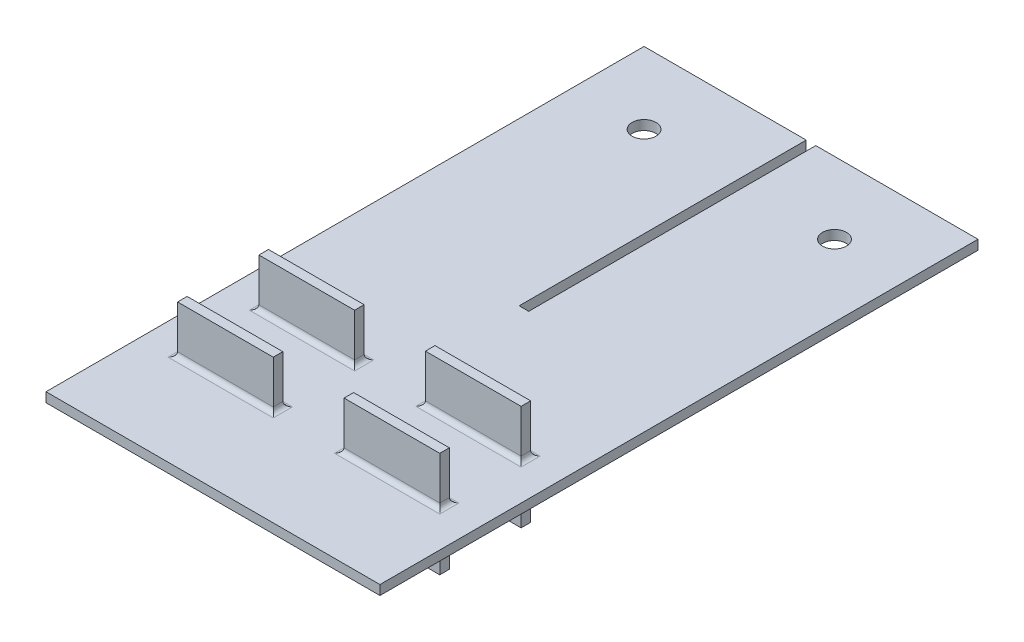
from build123d import *

# Parameters (mm, degrees)
SKETCH1_R           = 2.5
BOSS_EXTRUDE1_DEPTH = 1
SKETCH2_W           = 20
SKETCH2_H           = 2
BOSS_EXTRUDE2_DEPTH = 10
FILLET2_R           = 1
FILLET3_R           = 1


with BuildPart() as part:
    # Sketch1 → Boss-Extrude1 (new, symmetric)
    with BuildSketch(Plane(origin=(0, 0, 0), x_dir=(1, 0, 0), z_dir=(0, 1, 0))):
        Polygon((1, 62.5), (34.9, 62.5), (34.9, -62.5), (-34.9, -62.5), (-34.9, 62.5), (-1, 62.5), (-1, 2.5), (1, 2.5), align=None)
        with Locations(Location((-19.9, 47.5, 0), (0, 0, 270))):
            Circle(SKETCH1_R, mode=Mode.SUBTRACT)
        with Locations(Location((19.9, 47.5, 0), (0, 0, 270))):
            Circle(SKETCH1_R, mode=Mode.SUBTRACT)
    extrude(amount=BOSS_EXTRUDE1_DEPTH, both=True)

    # Sketch2 → Boss-Extrude2 (add)
    with BuildSketch(Plane(origin=(0, 1, 0), x_dir=(1, 0, 0), z_dir=(0, 1, 0))):
        with Locations((17.4, -24.5)):
            Rectangle(SKETCH2_W, SKETCH2_H)
        with Locations((17.4, -41.5)):
            Rectangle(SKETCH2_W, SKETCH2_H)
        with Locations((-17.4, -41.5)):
            Rectangle(SKETCH2_W, SKETCH2_H)
        with Locations((-17.4, -24.5)):
            Rectangle(SKETCH2_W, SKETCH2_H)
    boss_extrude2 = extrude(amount=BOSS_EXTRUDE2_DEPTH)

    # Mirror1: Boss-Extrude2 across plane
    add(boss_extrude2.mirror(Plane.ZX))

    # Fillet2
    fillet2_edges = [part.edges().sort_by_distance(p)[0] for p in [
        (7.4, -1, 24.5),
        (17.4, -1, 25.5),
        (27.4, -1, 24.5),
        (17.4, -1, 23.5),
        (7.4, -1, 41.5),
        (17.4, -1, 42.5),
        (27.4, -1, 41.5),
        (17.4, -1, 40.5),
        (-7.4, -1, 41.5),
        (-17.4, -1, 40.5),
        (-27.4, -1, 41.5),
        (-17.4, -1, 42.5),
        (-17.4, -1, 23.5),
        (-27.4, -1, 24.5),
        (-17.4, -1, 25.5),
        (-7.4, -1, 24.5),
    ]]
    fillet(fillet2_edges, radius=FILLET2_R)

    # Fillet3
    fillet3_edges = [part.edges().sort_by_distance(p)[0] for p in [
        (7.4, 1, 24.5),
        (17.4, 1, 25.5),
        (27.4, 1, 24.5),
        (17.4, 1, 23.5),
        (7.4, 1, 41.5),
        (17.4, 1, 42.5),
        (27.4, 1, 41.5),
        (17.4, 1, 40.5),
        (-7.4, 1, 41.5),
        (-17.4, 1, 40.5),
        (-27.4, 1, 41.5),
        (-17.4, 1, 42.5),
        (-17.4, 1, 23.5),
        (-27.4, 1, 24.5),
        (-17.4, 1, 25.5),
        (-7.4, 1, 24.5),
    ]]
    fillet(fillet3_edges, radius=FILLET3_R)


solid = part.part
